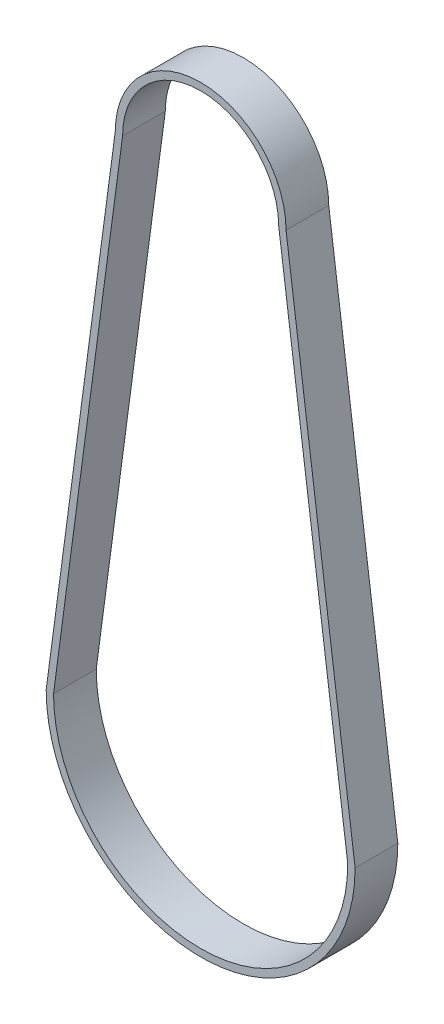
from build123d import *

# Parameters (mm, degrees)
AUFSATZ_LINEAR_AUSTRAGEN1_DEPTH      = 12.5
AUFSATZ_LINEAR_AUSTRAGEN1_DEPTH_BACK = 12.5


with BuildPart() as part:
    # Skizze3 → Aufsatz-Linear austragen1 (new, two sides: drawn at the far end of the back side and taken through both)
    with BuildSketch(Plane.XY.offset(-AUFSATZ_LINEAR_AUSTRAGEN1_DEPTH_BACK)):
        with BuildLine():
            Line((-49.975, 0), (-90.4, -303))
            ThreePointArc((-90.4, -303), (0, -393.4), (90.4, -303))
            Line((90.4, -303), (49.975, 0))
            ThreePointArc((49.975, 0), (0, 49.975), (-49.975, 0))
        make_face()
        with BuildLine():
            Line((86.1, -303), (45.675, 0))
            ThreePointArc((45.675, 0), (0, 45.675), (-45.675, 0))
            Line((-45.675, 0), (-86.1, -303))
            ThreePointArc((-86.1, -303), (0, -389.1), (86.1, -303))
        make_face(mode=Mode.SUBTRACT)
    extrude(amount=AUFSATZ_LINEAR_AUSTRAGEN1_DEPTH + AUFSATZ_LINEAR_AUSTRAGEN1_DEPTH_BACK)


solid = part.part
